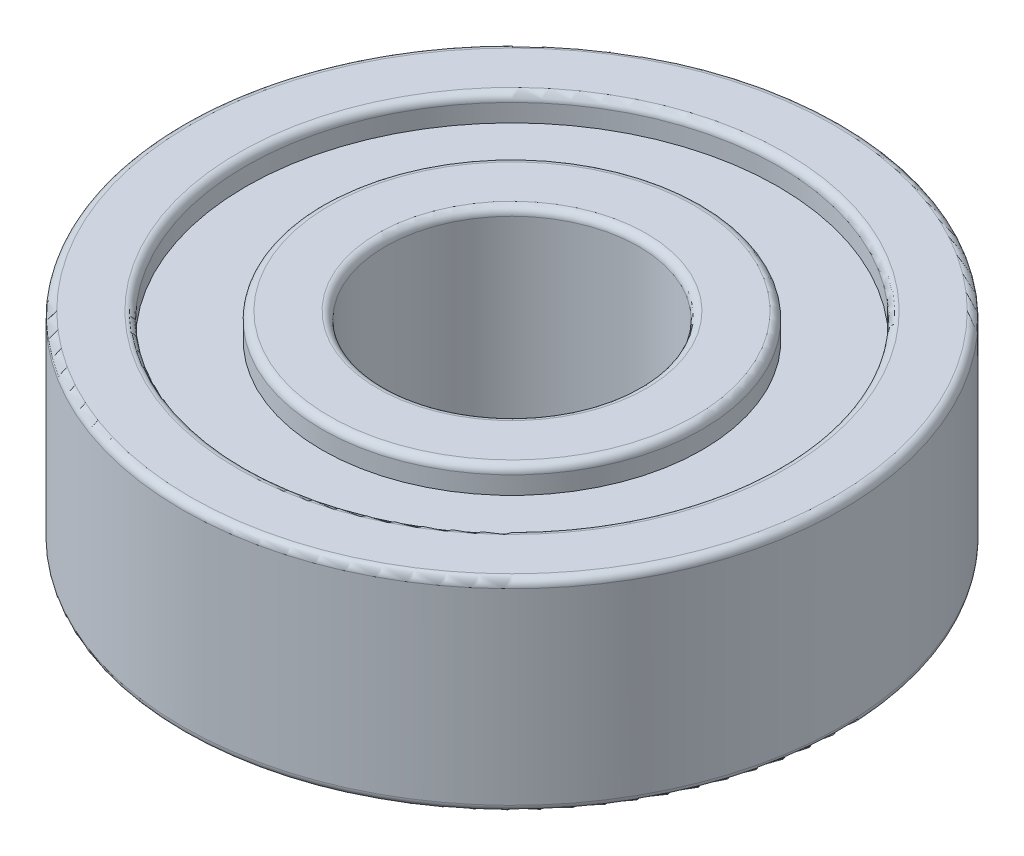
from build123d import *

# Parameters (mm, degrees)
FILLET_1_R = 0.3


with BuildPart() as part:
    # 草图1 → 旋转1 (revolve)
    with BuildSketch(Plane.XY, mode=Mode.PRIVATE) as revolve_1_sk:
        Polygon((5, 8), (5, 0), (7.5, 0), (7.5, 1), (10.5, 1), (10.5, 0), (13, 0), (13, 8), (10.5, 8), (10.5, 7), (7.5, 7), (7.5, 8), align=None)
    revolve(revolve_1_sk.sketch.rotate(Axis((0, 4.611296038, 0), (0, -1, 0)), 90), axis=Axis((0, 4.611296038, 0), (0, -1, 0)))

    # 圆角1
    fillet_1_edges = [part.edges().sort_by_distance(p)[0] for p in [
        (0, 8, -10.5),
        (0, 8, -13),
        (0, 0, -13),
        (0, 0, -10.5),
        (0, 0, -7.5),
        (0, 0, -5),
        (0, 8, -5),
        (0, 8, -7.5),
    ]]
    fillet(fillet_1_edges, radius=FILLET_1_R)


solid = part.part
